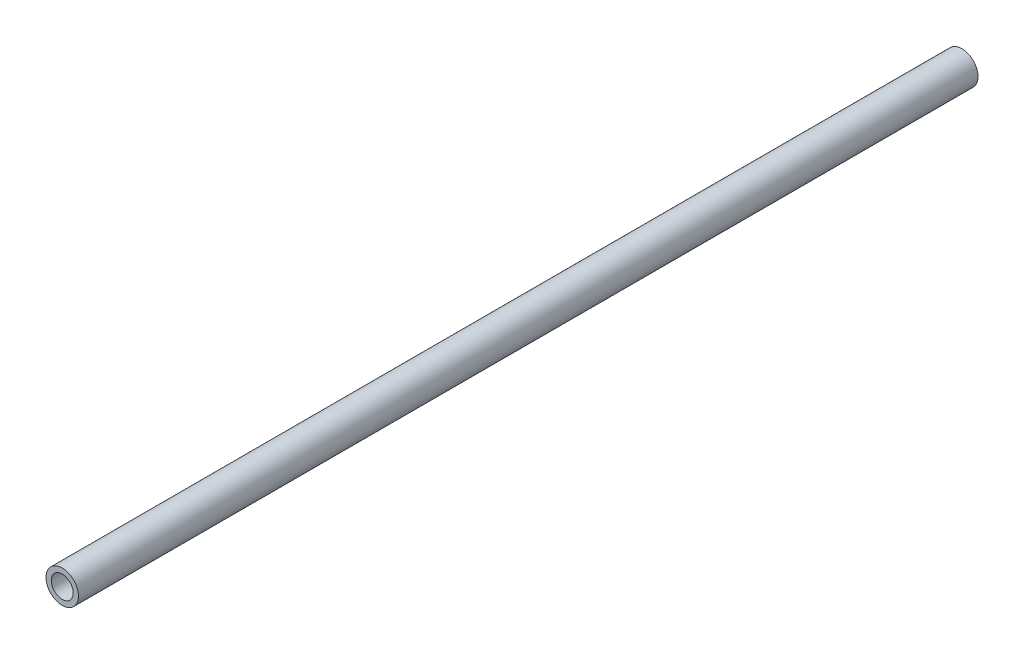
from build123d import *

# Parameters (mm, degrees)
SKETCH2_R           = 11
SKETCH2_R_2         = 7.444
BOSS_EXTRUDE1_DEPTH = 609.6


with BuildPart() as part:
    # Sketch2 → Boss-Extrude1 (new body)
    with BuildSketch(Plane.XY):
        with Locations(Location((29.195557492, 164.15, 0), (0, 0, 180))):
            Circle(SKETCH2_R)
        with Locations(Location((29.195557492, 164.15, 0), (0, 0, 180))):
            Circle(SKETCH2_R_2, mode=Mode.SUBTRACT)
    extrude(amount=BOSS_EXTRUDE1_DEPTH)


solid = part.part
